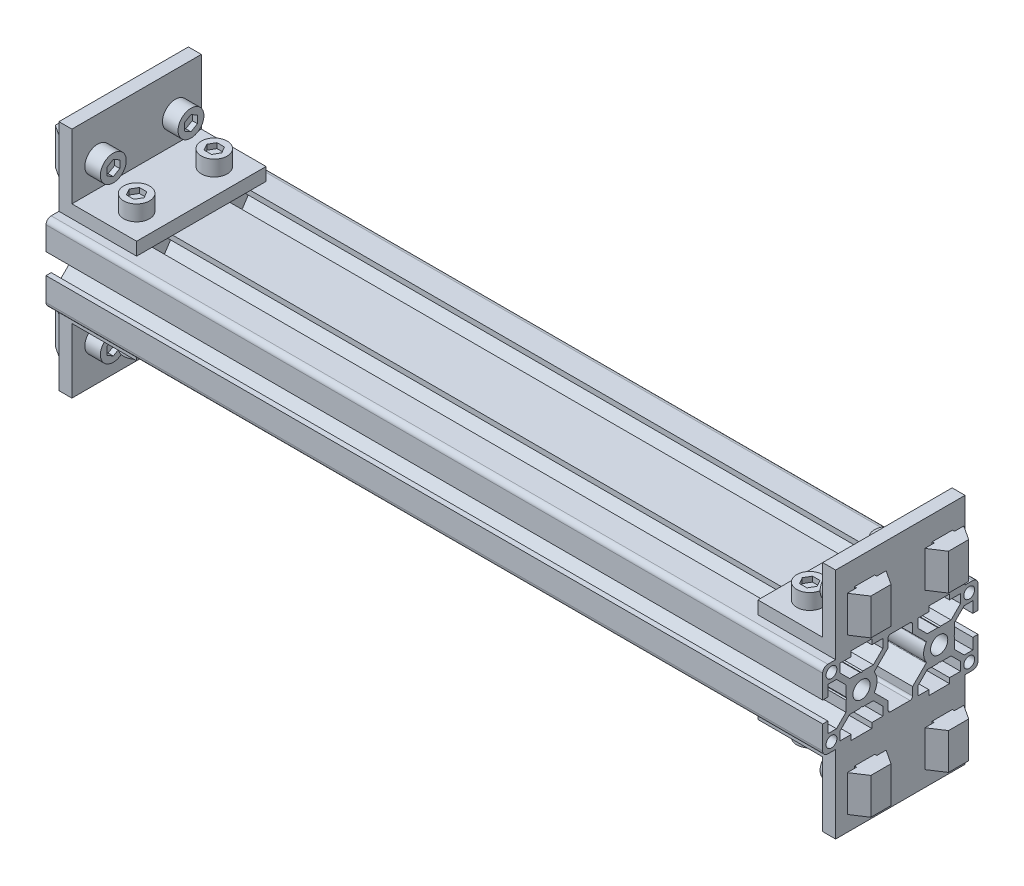
from build123d import *

# Parameters (mm, degrees)
SKETCH1_R             = 2.1
SKETCH1_R_2           = 3.3235
BOSS_EXTRUDE1_DEPTH   = 300
BOSS_EXTRUDE2_DEPTH   = 25
CUT_EXTRUDE1_DEPTH    = 2
BOSS_EXTRUDE3_DEPTH   = 7
CUT_EXTRUDE2_DEPTH    = 2
BOSS_EXTRUDE4_DEPTH   = 7
MIRROR2_COPY_2_DEPTH  = 2
MIRROR2_COPY_3_DEPTH  = 7
MIRROR2_COPY_5_DEPTH  = 2
MIRROR2_COPY_6_DEPTH  = 7
MIRROR3_COPY_2_DEPTH  = 2
MIRROR3_COPY_3_DEPTH  = 7
MIRROR3_COPY_5_DEPTH  = 2
MIRROR3_COPY_6_DEPTH  = 7
MIRROR3_COPY_7_DEPTH  = 25
MIRROR3_COPY_9_DEPTH  = 2
MIRROR3_COPY_10_DEPTH = 7
MIRROR3_COPY_12_DEPTH = 2
MIRROR3_COPY_13_DEPTH = 7
MIRROR3_COPY_15_DEPTH = 2
MIRROR3_COPY_16_DEPTH = 7
MIRROR3_COPY_18_DEPTH = 2
MIRROR3_COPY_19_DEPTH = 7


with BuildPart() as part:
    # Sketch1 → Boss-Extrude1 (new body)
    with BuildSketch(Plane(origin=(0, 0, 0), x_dir=(0, 0, -1), z_dir=(1, 0, 0))):
        with BuildLine():
            Line((-11, -15), (11, -15))
            Line((11, -15), (11, -13))
            Line((11, -13), (6.75, -13))
            Line((6.75, -13), (6.75, -9.664213562))
            Line((6.75, -9.664213562), (10.414213562, -6))
            Line((10.414213562, -6), (14.480384758, -6))
            Line((14.480384758, -6), (15, -5.7))
            Line((15, -5.7), (15.519615242, -6))
            Line((15.519615242, -6), (19.585786438, -6))
            Line((19.585786438, -6), (23.25, -9.664213562))
            Line((23.25, -9.664213562), (23.25, -13))
            Line((23.25, -13), (19, -13))
            Line((19, -13), (19, -15))
            Line((19, -15), (28, -15))
            ThreePointArc((28, -15), (29.414213562, -14.414213562), (30, -13))
            Line((30, -13), (30, -4))
            Line((30, -4), (28, -4))
            Line((28, -4), (28, -8.25))
            Line((28, -8.25), (24.664213562, -8.25))
            Line((24.664213562, -8.25), (21, -4.585786438))
            Line((21, -4.585786438), (21, -0.519615242))
            Line((21, -0.519615242), (20.7, 0))
            Line((20.7, 0), (21, 0.519615242))
            Line((21, 0.519615242), (21, 4.585786438))
            Line((21, 4.585786438), (24.664213562, 8.25))
            Line((24.664213562, 8.25), (28, 8.25))
            Line((28, 8.25), (28, 4))
            Line((28, 4), (30, 4))
            Line((30, 4), (30, 13))
            ThreePointArc((30, 13), (29.414213562, 14.414213562), (28, 15))
            Line((28, 15), (19, 15))
            Line((19, 15), (19, 13))
            Line((19, 13), (23.25, 13))
            Line((23.25, 13), (23.25, 9.664213562))
            Line((23.25, 9.664213562), (19.585786438, 6))
            Line((19.585786438, 6), (15.519615242, 6))
            Line((15.519615242, 6), (15, 5.7))
            Line((15, 5.7), (14.480384758, 6))
            Line((14.480384758, 6), (10.414213562, 6))
            Line((10.414213562, 6), (6.75, 9.664213562))
            Line((6.75, 9.664213562), (6.75, 13))
            Line((6.75, 13), (11, 13))
            Line((11, 13), (11, 15))
            Line((11, 15), (-11, 15))
            Line((-11, 15), (-11, 13))
            Line((-11, 13), (-6.75, 13))
            Line((-6.75, 13), (-6.75, 9.664213562))
            Line((-6.75, 9.664213562), (-10.414213562, 6))
            Line((-10.414213562, 6), (-14.480384758, 6))
            Line((-14.480384758, 6), (-15, 5.7))
            Line((-15, 5.7), (-15.519615242, 6))
            Line((-15.519615242, 6), (-19.585786438, 6))
            Line((-19.585786438, 6), (-23.25, 9.664213562))
            Line((-23.25, 9.664213562), (-23.25, 13))
            Line((-23.25, 13), (-19, 13))
            Line((-19, 13), (-19, 15))
            Line((-19, 15), (-28, 15))
            ThreePointArc((-28, 15), (-29.414213562, 14.414213562), (-30, 13))
            Line((-30, 13), (-30, 4))
            Line((-30, 4), (-28, 4))
            Line((-28, 4), (-28, 8.25))
            Line((-28, 8.25), (-24.664213562, 8.25))
            Line((-24.664213562, 8.25), (-21, 4.585786438))
            Line((-21, 4.585786438), (-21, 0.519615242))
            Line((-21, 0.519615242), (-20.7, 0))
            Line((-20.7, 0), (-21, -0.519615242))
            Line((-21, -0.519615242), (-21, -4.585786438))
            Line((-21, -4.585786438), (-24.664213562, -8.25))
            Line((-24.664213562, -8.25), (-28, -8.25))
            Line((-28, -8.25), (-28, -4))
            Line((-28, -4), (-30, -4))
            Line((-30, -4), (-30, -13))
            ThreePointArc((-30, -13), (-29.414213562, -14.414213562), (-28, -15))
            Line((-28, -15), (-19, -15))
            Line((-19, -15), (-19, -13))
            Line((-19, -13), (-23.25, -13))
            Line((-23.25, -13), (-23.25, -9.664213562))
            Line((-23.25, -9.664213562), (-19.585786438, -6))
            Line((-19.585786438, -6), (-15.519615242, -6))
            Line((-15.519615242, -6), (-15, -5.7))
            Line((-15, -5.7), (-14.480384758, -6))
            Line((-14.480384758, -6), (-10.414213562, -6))
            Line((-10.414213562, -6), (-6.75, -9.664213562))
            Line((-6.75, -9.664213562), (-6.75, -13))
            Line((-6.75, -13), (-11, -13))
            Line((-11, -13), (-11, -15))
        make_face()
        with Locations((-26.6, -11.6)):
            Circle(SKETCH1_R, mode=Mode.SUBTRACT)
        with Locations((-26.6, 11.6)):
            Circle(SKETCH1_R, mode=Mode.SUBTRACT)
        with Locations((-15, 0)):
            Circle(SKETCH1_R_2, mode=Mode.SUBTRACT)
        with Locations((26.6, -11.6)):
            Circle(SKETCH1_R, mode=Mode.SUBTRACT)
        with Locations((15, 0)):
            Circle(SKETCH1_R_2, mode=Mode.SUBTRACT)
        with Locations((26.6, 11.6)):
            Circle(SKETCH1_R, mode=Mode.SUBTRACT)
        with BuildLine():
            Line((4.75, 8.835786438), (4.75, 12))
            ThreePointArc((4.75, 12), (4.457106781, 12.707106781), (3.75, 13))
            Line((3.75, 13), (-3.75, 13))
            ThreePointArc((-3.75, 13), (-4.457106781, 12.707106781), (-4.75, 12))
            Line((-4.75, 12), (-4.75, 8.835786438))
            Line((-4.75, 8.835786438), (-9.933994275, 3.651792162))
            ThreePointArc((-9.933994275, 3.651792162), (-10.020243756, 3.470780401), (-9.973202134, 3.275866789))
            ThreePointArc((-9.973202134, 3.275866789), (-9, 0), (-9.973202134, -3.275866789))
            ThreePointArc((-9.973202134, -3.275866789), (-10.020243756, -3.470780401), (-9.933994275, -3.651792162))
            Line((-9.933994275, -3.651792162), (-4.75, -8.835786438))
            Line((-4.75, -8.835786438), (-4.75, -12))
            ThreePointArc((-4.75, -12), (-4.457106781, -12.707106781), (-3.75, -13))
            Line((-3.75, -13), (3.75, -13))
            ThreePointArc((3.75, -13), (4.457106781, -12.707106781), (4.75, -12))
            Line((4.75, -12), (4.75, -8.835786438))
            Line((4.75, -8.835786438), (9.933994275, -3.651792162))
            ThreePointArc((9.933994275, -3.651792162), (10.020243756, -3.470780401), (9.973202134, -3.275866789))
            ThreePointArc((9.973202134, -3.275866789), (9, 0), (9.973202134, 3.275866789))
            ThreePointArc((9.973202134, 3.275866789), (10.020243756, 3.470780401), (9.933994275, 3.651792162))
            Line((9.933994275, 3.651792162), (4.75, 8.835786438))
        make_face(mode=Mode.SUBTRACT)
    extrude(amount=BOSS_EXTRUDE1_DEPTH)

    # Sketch2 → Boss-Extrude2 (add, symmetric)
    with BuildSketch(Plane.XY):
        Polygon((0, 45), (0, 15), (30, 15), (30, 20), (5, 20), (5, 45), align=None)
    boss_extrude2 = extrude(amount=BOSS_EXTRUDE2_DEPTH, both=True)

    # Sketch3 → Revolve1 (revolve)
    with BuildSketch(Plane(origin=(20, 0, 0), x_dir=(0, 0, -1), z_dir=(1, 0, 0)), mode=Mode.PRIVATE) as revolve1_sk:
        Polygon((-15, 26), (-10, 26), (-10, 20), (-12, 20), (-12, 8), (-15, 8), align=None)
    revolve1 = revolve(revolve1_sk.sketch.rotate(Axis((20, 26, 15), (0, -1, 0)), 180), axis=Axis((20, 26, 15), (0, -1, 0)))

    # Sketch4 → Cut-Extrude1 (cut)
    with BuildSketch(Plane(origin=(0, 26, 0), x_dir=(1, 0, 0), z_dir=(0, 1, 0))):
        Polygon((22.886751346, -15), (21.443375673, -12.5), (18.556624327, -12.5), (17.113248654, -15), (18.556624327, -17.5), (21.443375673, -17.5), align=None)
    cut_extrude1 = extrude(amount=-CUT_EXTRUDE1_DEPTH, mode=Mode.SUBTRACT)

    # Sketch5 → Boss-Extrude3 (add, symmetric)
    with BuildSketch(Plane(origin=(20, 0, 0), x_dir=(0, 0, -1), z_dir=(1, 0, 0))):
        Polygon((-18.9, 13.8), (-11.1, 13.8), (-11.1, 13), (-7.5, 13), (-11.1, 7.5), (-18.9, 7.5), (-22.5, 13), (-18.9, 13), align=None)
    boss_extrude3 = extrude(amount=BOSS_EXTRUDE3_DEPTH, both=True)

    # Sketch6 → Revolve2 (revolve)
    with BuildSketch(Plane(origin=(0, 30, 0), x_dir=(1, 0, 0), z_dir=(0, 1, 0)), mode=Mode.PRIVATE) as revolve2_sk:
        Polygon((-7, -12), (5, -12), (5, -10), (11, -10), (11, -15), (-7, -15), align=None)
    revolve2 = revolve(revolve2_sk.sketch.rotate(Axis((-7, 30, 15), (1, 0, 0)), 180), axis=Axis((-7, 30, 15), (1, 0, 0)))

    # Sketch7 → Cut-Extrude2 (cut)
    with BuildSketch(Plane(origin=(11, 0, 0), x_dir=(0, 0, -1), z_dir=(1, 0, 0))):
        Polygon((-15, 32.886751346), (-17.5, 31.443375673), (-17.5, 28.556624327), (-15, 27.113248654), (-12.5, 28.556624327), (-12.5, 31.443375673), align=None)
    cut_extrude2 = extrude(amount=-CUT_EXTRUDE2_DEPTH, mode=Mode.SUBTRACT)

    # Sketch8 → Boss-Extrude4 (add, symmetric)
    with BuildSketch(Plane(origin=(0, 30, 0), x_dir=(1, 0, 0), z_dir=(0, 1, 0))):
        Polygon((-2, -7.5), (-7.5, -11.1), (-7.5, -18.9), (-2, -22.5), (-2, -18.9), (-1.2, -18.9), (-1.2, -11.1), (-2, -11.1), align=None)
    boss_extrude4 = extrude(amount=BOSS_EXTRUDE4_DEPTH, both=True)

    # Mirror1: Revolve1, Cut-Extrude1, Boss-Extrude3, Revolve2, Cut-Extrude2, Boss-Extrude4 across plane
    add(revolve1.mirror(Plane.XY))
    add(cut_extrude1.mirror(Plane.XY), mode=Mode.SUBTRACT)
    add(boss_extrude3.mirror(Plane.XY))
    add(revolve2.mirror(Plane.XY))
    add(cut_extrude2.mirror(Plane.XY), mode=Mode.SUBTRACT)
    add(boss_extrude4.mirror(Plane.XY))

    # Mirror2: Boss-Extrude2, Revolve1, Cut-Extrude1, Boss-Extrude3, Revolve2, Cut-Extrude2, Boss-Extrude4 across plane
    add(boss_extrude2.mirror(Plane.ZX))
    add(revolve1.mirror(Plane.ZX))
    add(cut_extrude1.mirror(Plane.ZX), mode=Mode.SUBTRACT)
    add(boss_extrude3.mirror(Plane.ZX))
    add(revolve2.mirror(Plane.ZX))
    add(cut_extrude2.mirror(Plane.ZX), mode=Mode.SUBTRACT)
    add(boss_extrude4.mirror(Plane.ZX))

    # Mirror2 copy 1 sketch → Mirror2 copy 1 (revolve)
    with BuildSketch(Plane(origin=(20, 0, 0), x_dir=(0, 0, 1), z_dir=(1, 0, 0))):
        Polygon((-15, 26), (-10, 26), (-10, 20), (-12, 20), (-12, 8), (-15, 8), align=None)
    revolve(axis=Axis((20, -26, -15), (0, 1, 0)))

    # Mirror2 copy 2 sketch → Mirror2 copy 2 (cut)
    with BuildSketch(Plane.XZ.offset(26)):
        Polygon((22.886751346, -15), (21.443375673, -12.5), (18.556624327, -12.5), (17.113248654, -15), (18.556624327, -17.5), (21.443375673, -17.5), align=None)
    extrude(amount=-MIRROR2_COPY_2_DEPTH, mode=Mode.SUBTRACT)

    # Mirror2 copy 3 sketch → Mirror2 copy 3 (add, symmetric)
    with BuildSketch(Plane(origin=(20, 0, 0), x_dir=(0, 0, 1), z_dir=(1, 0, 0))):
        Polygon((-18.9, 13.8), (-11.1, 13.8), (-11.1, 13), (-7.5, 13), (-11.1, 7.5), (-18.9, 7.5), (-22.5, 13), (-18.9, 13), align=None)
    extrude(amount=MIRROR2_COPY_3_DEPTH, both=True)

    # Mirror2 copy 4 sketch → Mirror2 copy 4 (revolve)
    with BuildSketch(Plane.XZ.offset(30)):
        Polygon((-7, -12), (5, -12), (5, -10), (11, -10), (11, -15), (-7, -15), align=None)
    revolve(axis=Axis((-7, -30, -15), (1, 0, 0)))

    # Mirror2 copy 5 sketch → Mirror2 copy 5 (cut)
    with BuildSketch(Plane(origin=(11, 0, 0), x_dir=(0, 0, 1), z_dir=(1, 0, 0))):
        Polygon((-15, 32.886751346), (-17.5, 31.443375673), (-17.5, 28.556624327), (-15, 27.113248654), (-12.5, 28.556624327), (-12.5, 31.443375673), align=None)
    extrude(amount=-MIRROR2_COPY_5_DEPTH, mode=Mode.SUBTRACT)

    # Mirror2 copy 6 sketch → Mirror2 copy 6 (add, symmetric)
    with BuildSketch(Plane.XZ.offset(30)):
        Polygon((-2, -7.5), (-7.5, -11.1), (-7.5, -18.9), (-2, -22.5), (-2, -18.9), (-1.2, -18.9), (-1.2, -11.1), (-2, -11.1), align=None)
    extrude(amount=MIRROR2_COPY_6_DEPTH, both=True)

    # Mirror3: Boss-Extrude2, Revolve1, Cut-Extrude1, Boss-Extrude3, Revolve2, Cut-Extrude2, Boss-Extrude4 across plane
    add(boss_extrude2.mirror(Plane(origin=(150, 0, 0), x_dir=(0, 0, 1), z_dir=(1, 0, 0))))
    add(revolve1.mirror(Plane(origin=(150, 0, 0), x_dir=(0, 0, 1), z_dir=(1, 0, 0))))
    add(cut_extrude1.mirror(Plane(origin=(150, 0, 0), x_dir=(0, 0, 1), z_dir=(1, 0, 0))), mode=Mode.SUBTRACT)
    add(boss_extrude3.mirror(Plane(origin=(150, 0, 0), x_dir=(0, 0, 1), z_dir=(1, 0, 0))))
    add(revolve2.mirror(Plane(origin=(150, 0, 0), x_dir=(0, 0, 1), z_dir=(1, 0, 0))))
    add(cut_extrude2.mirror(Plane(origin=(150, 0, 0), x_dir=(0, 0, 1), z_dir=(1, 0, 0))), mode=Mode.SUBTRACT)
    add(boss_extrude4.mirror(Plane(origin=(150, 0, 0), x_dir=(0, 0, 1), z_dir=(1, 0, 0))))

    # Mirror3 copy 1 sketch → Mirror3 copy 1 (revolve)
    with BuildSketch(Plane.ZY.offset(-280)):
        Polygon((-15, 26), (-10, 26), (-10, 20), (-12, 20), (-12, 8), (-15, 8), align=None)
    revolve(axis=Axis((280, 26, -15), (0, -1, 0)))

    # Mirror3 copy 2 sketch → Mirror3 copy 2 (cut)
    with BuildSketch(Plane(origin=(300, 26, 0), x_dir=(-1, 0, 0), z_dir=(0, 1, 0))):
        Polygon((22.886751346, -15), (21.443375673, -12.5), (18.556624327, -12.5), (17.113248654, -15), (18.556624327, -17.5), (21.443375673, -17.5), align=None)
    extrude(amount=-MIRROR3_COPY_2_DEPTH, mode=Mode.SUBTRACT)

    # Mirror3 copy 3 sketch → Mirror3 copy 3 (add, symmetric)
    with BuildSketch(Plane.ZY.offset(-280)):
        Polygon((-18.9, 13.8), (-11.1, 13.8), (-11.1, 13), (-7.5, 13), (-11.1, 7.5), (-18.9, 7.5), (-22.5, 13), (-18.9, 13), align=None)
    extrude(amount=MIRROR3_COPY_3_DEPTH, both=True)

    # Mirror3 copy 4 sketch → Mirror3 copy 4 (revolve)
    with BuildSketch(Plane(origin=(300, 30, 0), x_dir=(-1, 0, 0), z_dir=(0, 1, 0))):
        Polygon((-7, -12), (5, -12), (5, -10), (11, -10), (11, -15), (-7, -15), align=None)
    revolve(axis=Axis((307, 30, -15), (-1, 0, 0)))

    # Mirror3 copy 5 sketch → Mirror3 copy 5 (cut)
    with BuildSketch(Plane.ZY.offset(-289)):
        Polygon((-15, 32.886751346), (-17.5, 31.443375673), (-17.5, 28.556624327), (-15, 27.113248654), (-12.5, 28.556624327), (-12.5, 31.443375673), align=None)
    extrude(amount=-MIRROR3_COPY_5_DEPTH, mode=Mode.SUBTRACT)

    # Mirror3 copy 6 sketch → Mirror3 copy 6 (add, symmetric)
    with BuildSketch(Plane(origin=(300, 30, 0), x_dir=(-1, 0, 0), z_dir=(0, 1, 0))):
        Polygon((-2, -7.5), (-7.5, -11.1), (-7.5, -18.9), (-2, -22.5), (-2, -18.9), (-1.2, -18.9), (-1.2, -11.1), (-2, -11.1), align=None)
    extrude(amount=MIRROR3_COPY_6_DEPTH, both=True)

    # Mirror3 copy 7 sketch → Mirror3 copy 7 (add, symmetric)
    with BuildSketch(Plane(origin=(300, 0, 0), x_dir=(-1, 0, 0), z_dir=(0, 0, 1))):
        Polygon((0, 45), (0, 15), (30, 15), (30, 20), (5, 20), (5, 45), align=None)
    extrude(amount=MIRROR3_COPY_7_DEPTH, both=True)

    # Mirror3 copy 8 sketch → Mirror3 copy 8 (revolve)
    with BuildSketch(Plane(origin=(280, 0, 0), x_dir=(0, 0, -1), z_dir=(-1, 0, 0))):
        Polygon((-15, 26), (-10, 26), (-10, 20), (-12, 20), (-12, 8), (-15, 8), align=None)
    revolve(axis=Axis((280, -26, 15), (0, 1, 0)))

    # Mirror3 copy 9 sketch → Mirror3 copy 9 (cut)
    with BuildSketch(Plane(origin=(300, -26, 0), x_dir=(-1, 0, 0), z_dir=(0, -1, 0))):
        Polygon((22.886751346, -15), (21.443375673, -12.5), (18.556624327, -12.5), (17.113248654, -15), (18.556624327, -17.5), (21.443375673, -17.5), align=None)
    extrude(amount=-MIRROR3_COPY_9_DEPTH, mode=Mode.SUBTRACT)

    # Mirror3 copy 10 sketch → Mirror3 copy 10 (add, symmetric)
    with BuildSketch(Plane(origin=(280, 0, 0), x_dir=(0, 0, -1), z_dir=(-1, 0, 0))):
        Polygon((-18.9, 13.8), (-11.1, 13.8), (-11.1, 13), (-7.5, 13), (-11.1, 7.5), (-18.9, 7.5), (-22.5, 13), (-18.9, 13), align=None)
    extrude(amount=MIRROR3_COPY_10_DEPTH, both=True)

    # Mirror3 copy 11 sketch → Mirror3 copy 11 (revolve)
    with BuildSketch(Plane(origin=(300, -30, 0), x_dir=(-1, 0, 0), z_dir=(0, -1, 0))):
        Polygon((-7, -12), (5, -12), (5, -10), (11, -10), (11, -15), (-7, -15), align=None)
    revolve(axis=Axis((307, -30, 15), (-1, 0, 0)))

    # Mirror3 copy 12 sketch → Mirror3 copy 12 (cut)
    with BuildSketch(Plane(origin=(289, 0, 0), x_dir=(0, 0, -1), z_dir=(-1, 0, 0))):
        Polygon((-15, 32.886751346), (-17.5, 31.443375673), (-17.5, 28.556624327), (-15, 27.113248654), (-12.5, 28.556624327), (-12.5, 31.443375673), align=None)
    extrude(amount=-MIRROR3_COPY_12_DEPTH, mode=Mode.SUBTRACT)

    # Mirror3 copy 13 sketch → Mirror3 copy 13 (add, symmetric)
    with BuildSketch(Plane(origin=(300, -30, 0), x_dir=(-1, 0, 0), z_dir=(0, -1, 0))):
        Polygon((-2, -7.5), (-7.5, -11.1), (-7.5, -18.9), (-2, -22.5), (-2, -18.9), (-1.2, -18.9), (-1.2, -11.1), (-2, -11.1), align=None)
    extrude(amount=MIRROR3_COPY_13_DEPTH, both=True)

    # Mirror3 copy 14 sketch → Mirror3 copy 14 (revolve)
    with BuildSketch(Plane.ZY.offset(-280)):
        Polygon((-15, -26), (-10, -26), (-10, -20), (-12, -20), (-12, -8), (-15, -8), align=None)
    revolve(axis=Axis((280, -26, -15), (0, -1, 0)))

    # Mirror3 copy 15 sketch → Mirror3 copy 15 (cut)
    with BuildSketch(Plane(origin=(300, -26, 0), x_dir=(-1, 0, 0), z_dir=(0, -1, 0))):
        Polygon((22.886751346, 15), (21.443375673, 12.5), (18.556624327, 12.5), (17.113248654, 15), (18.556624327, 17.5), (21.443375673, 17.5), align=None)
    extrude(amount=-MIRROR3_COPY_15_DEPTH, mode=Mode.SUBTRACT)

    # Mirror3 copy 16 sketch → Mirror3 copy 16 (add, symmetric)
    with BuildSketch(Plane.ZY.offset(-280)):
        Polygon((-18.9, -13.8), (-11.1, -13.8), (-11.1, -13), (-7.5, -13), (-11.1, -7.5), (-18.9, -7.5), (-22.5, -13), (-18.9, -13), align=None)
    extrude(amount=MIRROR3_COPY_16_DEPTH, both=True)

    # Mirror3 copy 17 sketch → Mirror3 copy 17 (revolve)
    with BuildSketch(Plane(origin=(300, -30, 0), x_dir=(-1, 0, 0), z_dir=(0, -1, 0))):
        Polygon((-7, 12), (5, 12), (5, 10), (11, 10), (11, 15), (-7, 15), align=None)
    revolve(axis=Axis((307, -30, -15), (1, 0, 0)))

    # Mirror3 copy 18 sketch → Mirror3 copy 18 (cut)
    with BuildSketch(Plane.ZY.offset(-289)):
        Polygon((-15, -32.886751346), (-17.5, -31.443375673), (-17.5, -28.556624327), (-15, -27.113248654), (-12.5, -28.556624327), (-12.5, -31.443375673), align=None)
    extrude(amount=-MIRROR3_COPY_18_DEPTH, mode=Mode.SUBTRACT)

    # Mirror3 copy 19 sketch → Mirror3 copy 19 (add, symmetric)
    with BuildSketch(Plane(origin=(300, -30, 0), x_dir=(-1, 0, 0), z_dir=(0, -1, 0))):
        Polygon((-2, 7.5), (-7.5, 11.1), (-7.5, 18.9), (-2, 22.5), (-2, 18.9), (-1.2, 18.9), (-1.2, 11.1), (-2, 11.1), align=None)
    extrude(amount=MIRROR3_COPY_19_DEPTH, both=True)


solid = part.part
